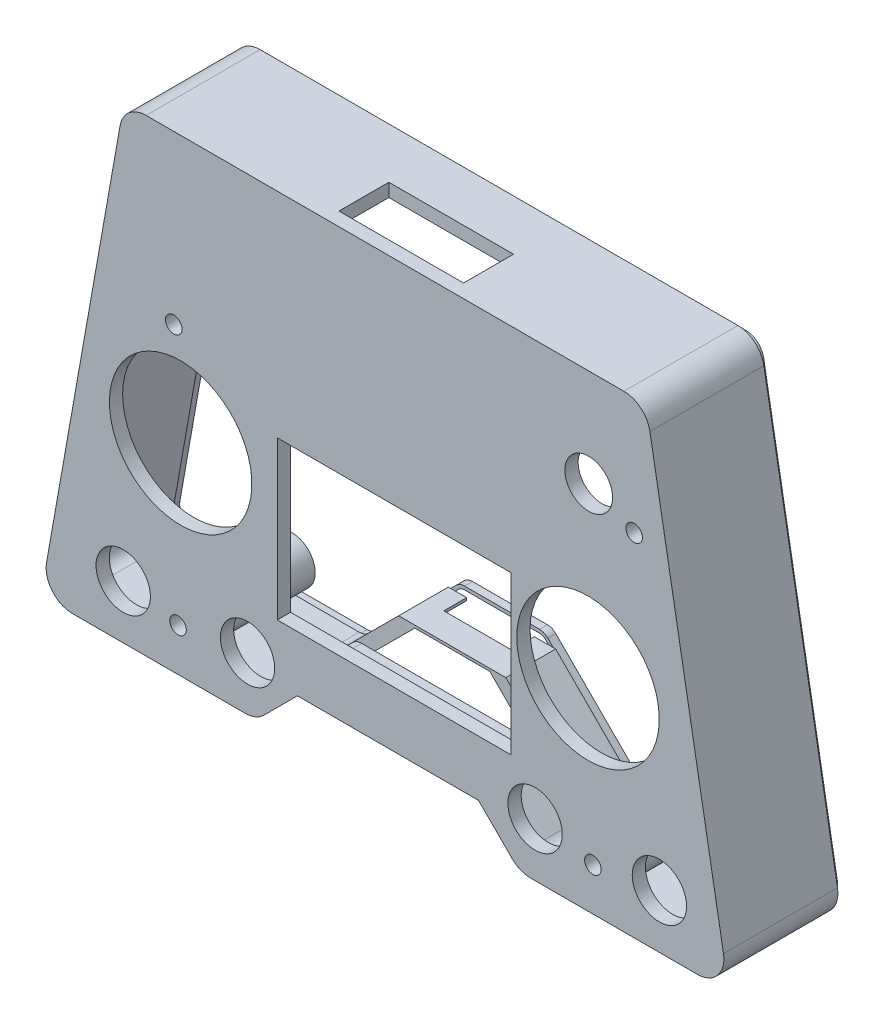
from build123d import *

# Parameters (mm, degrees)
EXTRUDE_17_2_DEPTH                             = 17.2
OLED_USB_START                                 = 7.5
OLED_USB_DEPTH                                 = 9.700000000000001
CUT_EXTRUDE_2_0_DEPTH                          = 15.2
OLED_START                                     = 7.5
OLED_DEPTH                                     = 7.7
SKETCH_5_R                                     = 2.5
SKETCH_5_R_2                                   = 2.500000000000002
SKETCH_5_R_3                                   = 3.5
SKETCH_5_R_4                                   = 3.500000000000003
EXTRUDE_741_DEPTH                              = 17.2
SKETCH_6_R                                     = 1.2500000000000002
SKETCH_6_R_2                                   = 1.250000000000001
SKETCH_6_R_3                                   = 1.25
CUT_EXTRUDE_M3_2_5_DEPTH                       = 93.42021351506384
EXTRUDE_START                                  = 5
SKETCH_7_W                                     = 4.713165999202246
SKETCH_7_H                                     = 2.4999999999999956
EXTRUDE_955_DEPTH                              = 12.2
CUT_EXTRUDE_START                              = 9.9
SKETCH_8_R                                     = 6.1999999999999975
CUT_EXTRUDE_1046_DEPTH                         = 5
SKETCH_9_R                                     = 1.250000000000001
CUT_EXTRUDE_1137_DEPTH                         = 93.42021351506384
SKETCH_10_R                                    = 10.75
SKETCH_10_R_2                                  = 10.749999999999996
SKETCH_10_R_3                                  = 4.1
SKETCH_10_R_4                                  = 4.099999999999999
SKETCH_10_R_5                                  = 4.100000000000007
SKETCH_10_R_6                                  = 3.599999999999999
FRONTPANEL_CONTROL_OPENINGS_DEPTH              = 93.42021351506384
SKETCH_11_W                                    = 35.30000000000001
SKETCH_11_H                                    = 23.799999999999997
OLED_0P96_FROM_HEADER_TOWARD_TYPEC_DEPTH       = 93.42021351506384
SKETCH_12_W                                    = 10.200000000000006
SKETCH_12_H                                    = 5
USB_TYPEC_SIDE_OPENING_DEPTH                   = 4
SKETCH_13_W                                    = 4.6
SKETCH_13_H                                    = 6.6499551868823445
SW13_TOGGLE_LEFT_SIDE_OPENING_2026_09_13_DEPTH = 4
SKETCH_14_W                                    = 18.8
SKETCH_14_H                                    = 7.53
NRF24_CORRECTED_2026_09_13_REAR_OPENING_DEPTH  = 4
PCB_0_25_DEPTH                                 = 1.2


with BuildPart() as part:
    # 草图1 → 上壳外形_高17.2 (new body)
    with BuildSketch(Plane.XY):
        with BuildLine():
            Line((-11.561, 23.55), (-22.663, -39.125))
            ThreePointArc((-22.663, -39.125), (-21.792108529649465, -42.381766357839346), (-18.737000000000002, -43.807))
            Line((-18.737000000000002, -43.807), (7.32, -43.807))
            ThreePointArc((7.32, -43.807), (8.845538475808986, -43.50380202511186), (10.139, -42.64000000000001))
            Line((10.139, -42.64000000000001), (23.192, -29.587))
            ThreePointArc((23.192, -29.587), (23.19610188321669, -29.58410423723755), (23.201, -29.583))
            Line((23.201, -29.583), (34.512, -29.583))
            ThreePointArc((34.512, -29.583), (34.51689811678331, -29.584104237237554), (34.521, -29.587))
            Line((34.521, -29.587), (47.574, -42.64000000000001))
            ThreePointArc((47.574, -42.64000000000001), (48.867461524191015, -43.50380202511187), (50.393, -43.807))
            Line((50.393, -43.807), (75.552, -43.807))
            ThreePointArc((75.552, -43.807), (78.60757740675032, -42.381973510531516), (79.479, -39.125))
            Line((79.479, -39.125), (68.376, 23.55))
            ThreePointArc((68.376, 23.55), (67.01177960240898, 25.910097423772065), (64.45, 26.842))
            Line((64.45, 26.842), (-7.635000000000001, 26.842))
            ThreePointArc((-7.635000000000001, 26.842), (-10.196779602408974, 25.91009742377206), (-11.561, 23.55))
        make_face()
    extrude(amount=EXTRUDE_17_2_DEPTH)

    # 草图2 → OLED前伸罩_下部避让USB (add)
    with BuildSketch(Plane.XY.offset(OLED_USB_START)):
        with BuildLine():
            Line((-11.561, 23.55), (-22.663, -39.125))
            ThreePointArc((-22.663, -39.125), (-21.792108529649465, -42.381766357839346), (-18.737000000000002, -43.807))
            Line((-18.737000000000002, -43.807), (7.32, -43.807))
            ThreePointArc((7.32, -43.807), (8.845538475808986, -43.50380202511186), (10.139, -42.64000000000001))
            Line((10.139, -42.64000000000001), (15.192, -37.587))
            ThreePointArc((15.192, -37.587), (15.196101883216691, -37.58410423723756), (15.201, -37.583))
            Line((15.201, -37.583), (42.512, -37.583))
            ThreePointArc((42.512, -37.583), (42.51689811678331, -37.584104237237554), (42.521, -37.587))
            Line((42.521, -37.587), (47.574, -42.64000000000001))
            ThreePointArc((47.574, -42.64000000000001), (48.867461524191015, -43.50380202511187), (50.393, -43.807))
            Line((50.393, -43.807), (75.552, -43.807))
            ThreePointArc((75.552, -43.807), (78.60757740675032, -42.381973510531516), (79.479, -39.125))
            Line((79.479, -39.125), (68.376, 23.55))
            ThreePointArc((68.376, 23.55), (67.01177960240898, 25.910097423772065), (64.45, 26.842))
            Line((64.45, 26.842), (-7.635000000000001, 26.842))
            ThreePointArc((-7.635000000000001, 26.842), (-10.196779602408974, 25.91009742377206), (-11.561, 23.55))
        make_face()
    extrude(amount=OLED_USB_DEPTH)

    # 草图3 → 内部腔体_壁厚2.0 (cut)
    with BuildSketch(Plane.XY):
        with BuildLine():
            Line((-9.591000000000001, 23.202000000000005), (-20.693, -39.473))
            ThreePointArc((-20.693, -39.473), (-20.259551642513195, -41.09635947418843), (-18.737000000000002, -41.807))
            Line((-18.737000000000002, -41.807), (7.32, -41.807))
            ThreePointArc((7.32, -41.807), (8.080257195993655, -41.65617101612923), (8.725000000000001, -41.226))
            Line((8.725000000000001, -41.226), (21.778, -28.173000000000002))
            ThreePointArc((21.778, -28.173000000000002), (22.430820843783202, -27.73647383170085), (23.201, -27.583))
            Line((23.201, -27.583), (34.512, -27.583))
            ThreePointArc((34.512, -27.583), (35.2821791562168, -27.736473831700845), (35.935, -28.173000000000002))
            Line((35.935, -28.173000000000002), (48.98800000000001, -41.226))
            ThreePointArc((48.98800000000001, -41.226), (49.63274280400635, -41.65617101612923), (50.393, -41.807))
            Line((50.393, -41.807), (75.552, -41.807))
            ThreePointArc((75.552, -41.807), (77.0750204222898, -41.09656660943493), (77.50900000000001, -39.473))
            Line((77.50900000000001, -39.473), (66.406, 23.202000000000005))
            ThreePointArc((66.406, 23.202000000000005), (65.72621342599425, 24.37767406173459), (64.45, 24.842))
            Line((64.45, 24.842), (-7.635000000000001, 24.842))
            ThreePointArc((-7.635000000000001, 24.842), (-8.911213425994234, 24.377674061734588), (-9.591000000000001, 23.202000000000005))
        make_face()
    extrude(amount=CUT_EXTRUDE_2_0_DEPTH, mode=Mode.SUBTRACT)

    # 草图4 → OLED前伸内腔 (cut)
    with BuildSketch(Plane.XY.offset(OLED_START)):
        with BuildLine():
            Line((-9.591000000000001, 23.202000000000005), (-20.693, -39.473))
            ThreePointArc((-20.693, -39.473), (-20.259551642513195, -41.09635947418843), (-18.737000000000002, -41.807))
            Line((-18.737000000000002, -41.807), (7.32, -41.807))
            ThreePointArc((7.32, -41.807), (8.080257195993655, -41.65617101612923), (8.725000000000001, -41.226))
            Line((8.725000000000001, -41.226), (13.777999999999999, -36.173))
            ThreePointArc((13.777999999999999, -36.173), (14.430820843783206, -35.73647383170085), (15.201, -35.583))
            Line((15.201, -35.583), (42.512, -35.583))
            ThreePointArc((42.512, -35.583), (43.2821791562168, -35.73647383170085), (43.935, -36.173))
            Line((43.935, -36.173), (48.98800000000001, -41.226))
            ThreePointArc((48.98800000000001, -41.226), (49.63274280400635, -41.65617101612923), (50.393, -41.807))
            Line((50.393, -41.807), (75.552, -41.807))
            ThreePointArc((75.552, -41.807), (77.0750204222898, -41.09656660943493), (77.50900000000001, -39.473))
            Line((77.50900000000001, -39.473), (66.406, 23.202000000000005))
            ThreePointArc((66.406, 23.202000000000005), (65.72621342599425, 24.37767406173459), (64.45, 24.842))
            Line((64.45, 24.842), (-7.635000000000001, 24.842))
            ThreePointArc((-7.635000000000001, 24.842), (-8.911213425994234, 24.377674061734588), (-9.591000000000001, 23.202000000000005))
        make_face()
    extrude(amount=OLED_DEPTH, mode=Mode.SUBTRACT)

    # 草图5 → Extrude 741 (add)
    with BuildSketch(Plane.XY):
        with Locations(Location((-3.469, 1.614, 0), (0, 0, 180))):
            Circle(SKETCH_5_R)
        with Locations(Location((66, 9.107, 0), (0, 0, 180))):
            Circle(SKETCH_5_R_2)
        with Locations(Location((-2.8220000000000005, -37.375, 0), (0, 0, 180))):
            Circle(SKETCH_5_R_3)
        with Locations(Location((59.778, -37.375, 0), (0, 0, 180))):
            Circle(SKETCH_5_R_4)
    extrude(amount=EXTRUDE_741_DEPTH)

    # 草图6 → M3自攻底孔_直径2.5 (cut, through all)
    with BuildSketch(Plane.XY):
        with Locations(Location((-3.469, 1.614, 0), (0, 0, 180))):
            Circle(SKETCH_6_R)
        with Locations(Location((66, 9.107, 0), (0, 0, 180))):
            Circle(SKETCH_6_R_2)
        with Locations(Location((-2.8220000000000005, -37.375, 0), (0, 0, 180))):
            Circle(SKETCH_6_R_3)
        with Locations(Location((59.778, -37.375, 0), (0, 0, 180))):
            Circle(SKETCH_6_R_2)
    extrude(amount=CUT_EXTRUDE_M3_2_5_DEPTH, mode=Mode.SUBTRACT)

    # 草图7 → Extrude 955 (add)
    with BuildSketch(Plane.XY.offset(EXTRUDE_START)):
        with Locations((68.35658299960113, 9.106999999999996)):
            Rectangle(SKETCH_7_W, SKETCH_7_H)
    extrude(amount=EXTRUDE_955_DEPTH)

    # 草图8 → Cut-Extrude 1046 (cut)
    with BuildSketch(Plane.XY.offset(CUT_EXTRUDE_START)):
        with Locations((59.353, 11.774)):
            Circle(SKETCH_8_R)
    extrude(amount=CUT_EXTRUDE_1046_DEPTH, mode=Mode.SUBTRACT)

    # 草图9 → Cut-Extrude 1137 (cut, through all)
    with BuildSketch(Plane.XY):
        with Locations((66, 9.107)):
            Circle(SKETCH_9_R)
    extrude(amount=CUT_EXTRUDE_1137_DEPTH, mode=Mode.SUBTRACT)

    # 草图10 → FrontPanel_Control_Openings (cut, through all)
    with BuildSketch(Plane.XY):
        with Locations(Location((-2.427, -13.356, 0), (0, 0, 180))):
            Circle(SKETCH_10_R)
        with Locations(Location((59.041, -13.356, 0), (0, 0, 180))):
            Circle(SKETCH_10_R_2)
        with Locations(Location((-11.089, -35.723, 0), (0, 0, 180))):
            Circle(SKETCH_10_R_3)
        with Locations(Location((7.669, -35.723, 0), (0, 0, 180))):
            Circle(SKETCH_10_R_4)
        with Locations(Location((51.053000000000004, -35.723, 0), (0, 0, 180))):
            Circle(SKETCH_10_R_3)
        with Locations(Location((69.81, -35.723, 0), (0, 0, 180))):
            Circle(SKETCH_10_R_5)
        with Locations(Location((59.147, 12.097, 0), (0, 0, 180))):
            Circle(SKETCH_10_R_6)
    extrude(amount=FRONTPANEL_CONTROL_OPENINGS_DEPTH, mode=Mode.SUBTRACT)

    # 草图11 → OLED_0p96_From_Header_Toward_TypeC (cut, through all)
    with BuildSketch(Plane.XY):
        with Locations((29.805, -17.285)):
            Rectangle(SKETCH_11_W, SKETCH_11_H)
    extrude(amount=OLED_0P96_FROM_HEADER_TOWARD_TYPEC_DEPTH, mode=Mode.SUBTRACT)

    # 草图12 → USB_TypeC_Side_Opening (cut)
    with BuildSketch(Plane.XZ.offset(29.583)):
        with Locations((28.634, 0.9500000000000001)):
            Rectangle(SKETCH_12_W, SKETCH_12_H)
    extrude(amount=-USB_TYPEC_SIDE_OPENING_DEPTH, mode=Mode.SUBTRACT)

    # 草图13 → SW13_Toggle_Left_Side_Opening_2026-09-13_OBJ (cut)
    with BuildSketch(Plane(origin=(-15.253928164703426, 2.7020201114405644, 0), x_dir=(0, 0, 1), z_dir=(-0.9846712170135259, 0.17442073954980714, 0))):
        with Locations((3.3, 11.317450249547845)):
            Rectangle(SKETCH_13_W, SKETCH_13_H)
    extrude(amount=-SW13_TOGGLE_LEFT_SIDE_OPENING_2026_09_13_DEPTH, mode=Mode.SUBTRACT)

    # 草图14 → NRF24_Corrected_2026-09-13_Rear_Opening (cut)
    with BuildSketch(Plane(origin=(0, 26.842, 0), x_dir=(1, 0, 0), z_dir=(0, 1, 0))):
        with Locations((28.810000000000002, -11.385)):
            Rectangle(SKETCH_14_W, SKETCH_14_H)
    extrude(amount=-NRF24_CORRECTED_2026_09_13_REAR_OPENING_DEPTH, mode=Mode.SUBTRACT)

    # 草图15 → 内定位舌_避让最新PCB_0.25 (add)
    with BuildSketch(Plane.XY):
        with BuildLine():
            Line((-10.32975, 23.332500000000003), (-21.431750000000005, -39.3425))
            ThreePointArc((-21.431750000000005, -39.3425), (-20.83426044671693, -41.578387053209035), (-18.737000000000002, -42.557))
            Line((-18.737000000000002, -42.557), (7.32, -42.557))
            ThreePointArc((7.32, -42.557), (8.36723766804936, -42.349032637642864), (9.25525, -41.75625))
            Line((9.25525, -41.75625), (22.30825, -28.703249999999997))
            ThreePointArc((22.30825, -28.703249999999997), (22.717801339935214, -28.429335472591927), (23.201, -28.333000000000002))
            Line((23.201, -28.333000000000002), (34.512, -28.333000000000002))
            ThreePointArc((34.512, -28.333000000000002), (34.99519866006479, -28.429335472591927), (35.40475, -28.703249999999997))
            Line((35.40475, -28.703249999999997), (48.457750000000004, -41.75625))
            ThreePointArc((48.457750000000004, -41.75625), (49.345762331950645, -42.349032637642864), (50.393, -42.557))
            Line((50.393, -42.557), (75.552, -42.557))
            ThreePointArc((75.552, -42.557), (77.64972927966592, -41.578594197980834), (78.24775000000001, -39.3425))
            Line((78.24775000000001, -39.3425), (67.14475, 23.332500000000003))
            ThreePointArc((67.14475, 23.332500000000003), (66.2083007338109, 24.952332815307344), (64.45, 25.592))
            Line((64.45, 25.592), (-7.635000000000001, 25.592))
            ThreePointArc((-7.635000000000001, 25.592), (-9.393300733810905, 24.952332815307344), (-10.32975, 23.332500000000003))
        make_face()
        with BuildLine():
            Line((-9.837250000000001, 23.2455), (-20.93925, -39.4295))
            ThreePointArc((-20.93925, -39.4295), (-20.451121237147458, -41.25703533330466), (-18.737000000000002, -42.057))
            Line((-18.737000000000002, -42.057), (7.32, -42.057))
            ThreePointArc((7.32, -42.057), (8.175917351474741, -41.88712488833805), (8.901750000000002, -41.40275))
            Line((8.901750000000002, -41.40275), (21.954749999999997, -28.34975))
            ThreePointArc((21.954749999999997, -28.34975), (22.526481009264852, -27.96742771223285), (23.201, -27.833))
            Line((23.201, -27.833), (34.512, -27.833))
            ThreePointArc((34.512, -27.833), (35.186518990735145, -27.96742771223285), (35.758250000000004, -28.34975))
            Line((35.758250000000004, -28.34975), (48.81125, -41.40275))
            ThreePointArc((48.81125, -41.40275), (49.537082648525256, -41.88712488833806), (50.393, -42.057))
            Line((50.393, -42.057), (75.552, -42.057))
            ThreePointArc((75.552, -42.057), (77.26659003861201, -41.25724247243459), (77.75525000000002, -39.4295))
            Line((77.75525000000002, -39.4295), (66.65225000000001, 23.2455))
            ThreePointArc((66.65225000000001, 23.2455), (65.88690919328468, 24.56922697788312), (64.45, 25.092))
            Line((64.45, 25.092), (-7.635000000000001, 25.092))
            ThreePointArc((-7.635000000000001, 25.092), (-9.071909193284675, 24.569226977883115), (-9.837250000000001, 23.2455))
        make_face(mode=Mode.SUBTRACT)
    extrude(amount=-PCB_0_25_DEPTH)


solid = part.part
